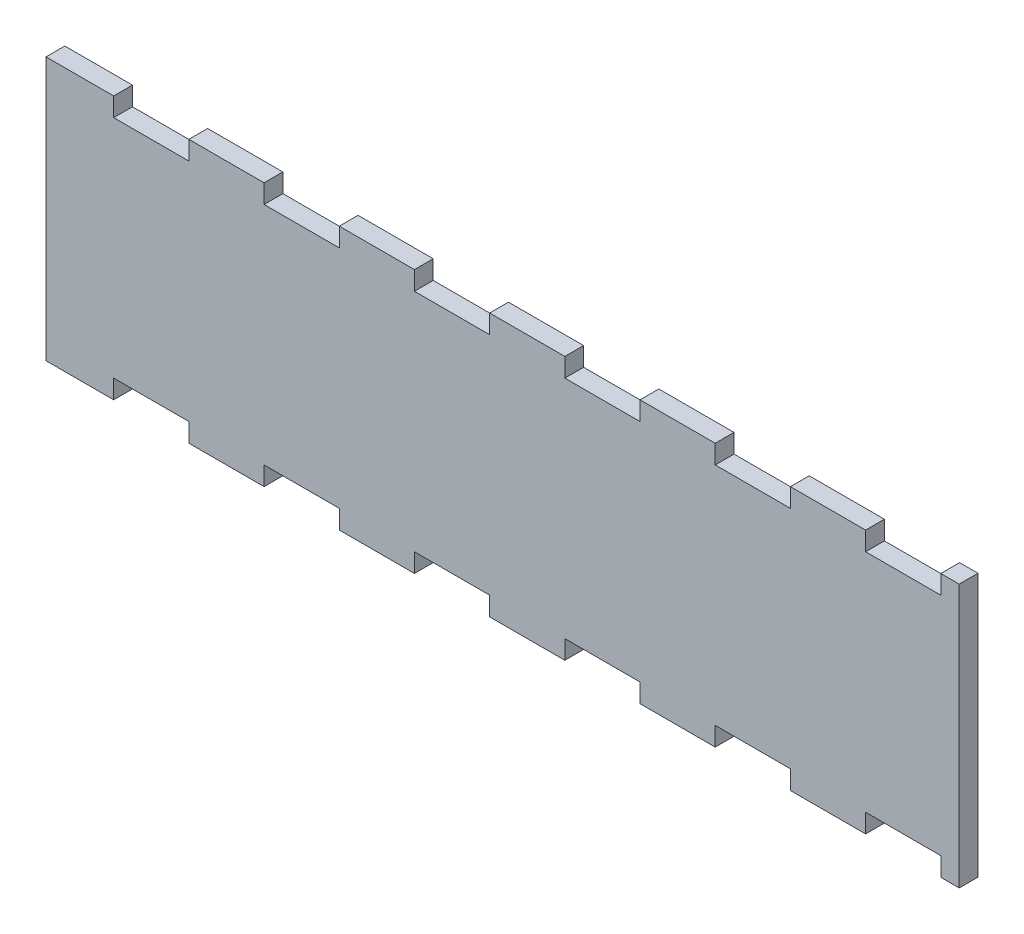
from build123d import *

# Parameters (mm, degrees)
BOSS_EXTRUDE1_DEPTH = 3.175
SKETCH2_W           = 3.175
SKETCH2_H           = 44.45
CUT_EXTRUDE1_DEPTH  = 1.27


with BuildPart() as part:
    # Sketch1 → Boss-Extrude1 (new body)
    with BuildSketch(Plane.XY):
        Polygon((0, 0), (0, -44.45), (12.7, -44.45), (12.7, -41.275), (25.4, -41.275), (25.4, -44.45), (38.1, -44.45), (38.1, -41.275), (50.8, -41.275), (50.8, -44.45), (63.5, -44.45), (63.5, -41.275), (76.2, -41.275), (76.2, -44.45), (88.9, -44.45), (88.9, -41.275), (101.6, -41.275), (101.6, -44.45), (114.3, -44.45), (114.3, -41.275), (127, -41.275), (127, -44.45), (139.7, -44.45), (139.7, -41.275), (152.4, -41.275), (152.4, -44.45), (155.507436, -44.45), (155.507436, 0), (152.4, 0), (152.4, -3.175), (139.7, -3.175), (139.7, 0), (127, 0), (127, -3.175), (114.3, -3.175), (114.3, 0), (101.6, 0), (101.6, -3.175), (88.9, -3.175), (88.9, 0), (76.2, 0), (76.2, -3.175), (63.5, -3.175), (63.5, 0), (50.8, 0), (50.8, -3.175), (38.1, -3.175), (38.1, 0), (25.4, 0), (25.4, -3.175), (12.7, -3.175), (12.7, 0), align=None)
    extrude(amount=BOSS_EXTRUDE1_DEPTH)

    # Sketch2 → Cut-Extrude1 (cut)
    with BuildSketch(Plane.ZY):
        with Locations((1.5875, -22.225)):
            Rectangle(SKETCH2_W, SKETCH2_H)
    extrude(amount=-CUT_EXTRUDE1_DEPTH, mode=Mode.SUBTRACT)


solid = part.part
